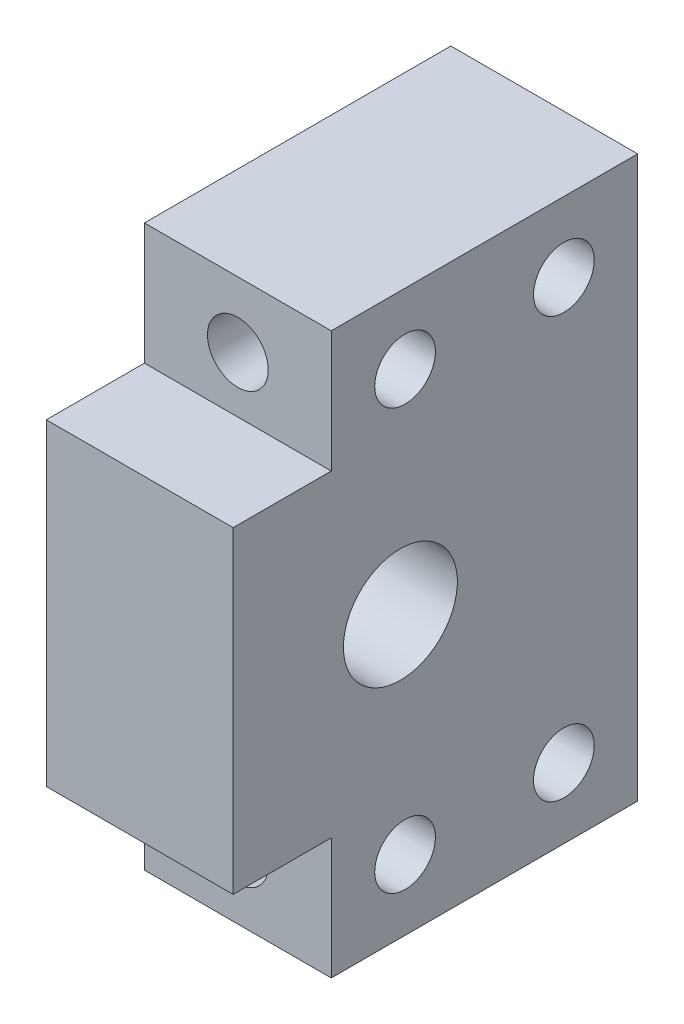
from build123d import *

# Parameters (mm, degrees)
SKETCH1_W           = 20
SKETCH1_H           = 13
SKETCH1_R           = 3.25
SKETCH1_H_2         = 34
BOSS_EXTRUDE1_DEPTH = 32.8
BOSS_EXTRUDE2_START = 32.8
SKETCH1_3_W         = 20
SKETCH1_3_H         = 34
BOSS_EXTRUDE2_DEPTH = 10.5
SKETCH2_OUTSIDE_W   = 60.63
SKETCH2_OUTSIDE_H   = 77.33
SKETCH2_OUTSIDE_R   = 6.1
SKETCH2_OUTSIDE_R_2 = 3.25
CUT_EXTRUDE1_DEPTH  = 295.275


with BuildPart() as part:
    # Sketch1 → Boss-Extrude1 (new body)
    # profile 1 of 3: a face of its own
    with BuildSketch(Plane.XY):
        with Locations((-285.275, 23.5)):
            Rectangle(SKETCH1_W, SKETCH1_H)
        with Locations((-285.275, 23)):
            Circle(SKETCH1_R, mode=Mode.SUBTRACT)
    # profile 2 of 3: a face of its own
    with BuildSketch(Plane.XY):
        with Locations((-285.275, 0)):
            Rectangle(SKETCH1_W, SKETCH1_H_2)
    # profile 3 of 3: a face of its own
    with BuildSketch(Plane.XY):
        with Locations((-285.275, -23.5)):
            Rectangle(SKETCH1_W, SKETCH1_H)
        with Locations((-285.275, -23)):
            Circle(SKETCH1_R, mode=Mode.SUBTRACT)
    extrude(amount=BOSS_EXTRUDE1_DEPTH)

    # Sketch1<3> → Boss-Extrude2 (add)
    with BuildSketch(Plane.XY.offset(BOSS_EXTRUDE2_START)):
        with Locations((-285.275, 0)):
            Rectangle(SKETCH1_3_W, SKETCH1_3_H)
    extrude(amount=BOSS_EXTRUDE2_DEPTH)

    # Sketch2 outside → Cut-Extrude1 (cut)
    # profile 1 of 6: a face of its own
    with BuildSketch(Plane(origin=(0, 0, 0), x_dir=(0, 0, -1), z_dir=(1, 0, 0))):
        with Locations((-21.65, 0)):
            Rectangle(SKETCH2_OUTSIDE_W, SKETCH2_OUTSIDE_H)
        Polygon((0, -30), (0, 30), (-32.8, 30), (-32.8, 17), (-43.3, 17), (-43.3, -17), (-32.8, -17), (-32.8, -30), align=None, mode=Mode.SUBTRACT)
    # profile 2 of 6: a face of its own
    with BuildSketch(Plane(origin=(0, 0, 0), x_dir=(0, 0, -1), z_dir=(1, 0, 0))):
        with Locations(Location((-25.4, 0, 0), (0, 0, 180))):
            Circle(SKETCH2_OUTSIDE_R)
    # profile 3 of 6: a face of its own
    with BuildSketch(Plane(origin=(0, 0, 0), x_dir=(0, 0, -1), z_dir=(1, 0, 0))):
        with Locations(Location((-7.9, -22.5, 0), (0, 0, 180))):
            Circle(SKETCH2_OUTSIDE_R_2)
    # profile 4 of 6: a face of its own
    with BuildSketch(Plane(origin=(0, 0, 0), x_dir=(0, 0, -1), z_dir=(1, 0, 0))):
        with Locations(Location((-24.9, -22.5, 0), (0, 0, 180))):
            Circle(SKETCH2_OUTSIDE_R_2)
    # profile 5 of 6: a face of its own
    with BuildSketch(Plane(origin=(0, 0, 0), x_dir=(0, 0, -1), z_dir=(1, 0, 0))):
        with Locations(Location((-24.9, 22.5, 0), (0, 0, 180))):
            Circle(SKETCH2_OUTSIDE_R_2)
    # profile 6 of 6: a face of its own
    with BuildSketch(Plane(origin=(0, 0, 0), x_dir=(0, 0, -1), z_dir=(1, 0, 0))):
        with Locations(Location((-7.9, 22.5, 0), (0, 0, 180))):
            Circle(SKETCH2_OUTSIDE_R_2)
    extrude(amount=-CUT_EXTRUDE1_DEPTH, mode=Mode.SUBTRACT)


solid = part.part
